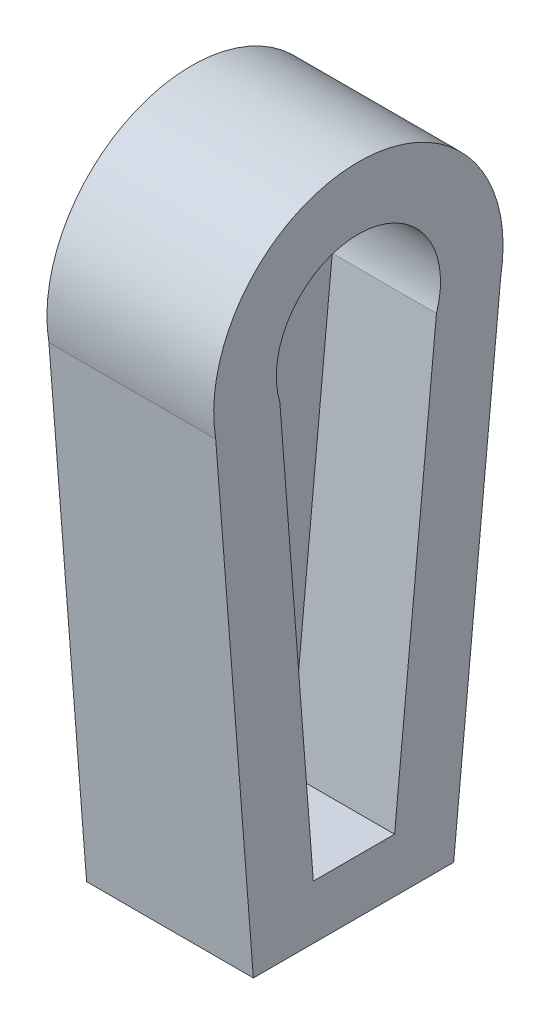
from build123d import *

# Parameters (mm, degrees)
BOSS_EXTRUDE1_DEPTH = 8
SKETCH1_3_R         = 2.375
BOSS_EXTRUDE2_DEPTH = 3


with BuildPart() as part:
    # Sketch1 → Boss-Extrude1 (new body)
    with BuildSketch(Plane(origin=(0, 0, 0), x_dir=(0, 0, -1), z_dir=(1, 0, 0))):
        with BuildLine():
            ThreePointArc((6.831434318, -1.221589567), (0.037477219, 6.939695337), (-6.84422965, -1.147735338))
            Line((-6.84422965, -1.147735338), (-5.036656509, -24.443075278))
            Line((-5.036656509, -24.443075278), (4.569647847, -24.443075278))
            Line((4.569647847, -24.443075278), (6.831434318, -1.221589567))
        make_face()
        with BuildLine():
            Line((-2.162031314, -21.856629017), (-3.768912351, -1.147735338))
            ThreePointArc((-3.768912351, -1.147735338), (0.038719155, 3.939606268), (3.745626202, -1.221589567))
            Line((3.745626202, -1.221589567), (1.73576113, -21.856629017))
            Line((1.73576113, -21.856629017), (-2.162031314, -21.856629017))
        make_face(mode=Mode.SUBTRACT)
    extrude(amount=BOSS_EXTRUDE1_DEPTH)

    # Sketch1<3> → Boss-Extrude2 (add)
    with BuildSketch(Plane(origin=(0, 0, 0), x_dir=(0, 0, -1), z_dir=(1, 0, 0))):
        with BuildLine():
            ThreePointArc((3.745626202, -1.221589567), (0.038719155, 3.939606268), (-3.768912351, -1.147735338))
            Line((-3.768912351, -1.147735338), (-2.162031314, -21.856629017))
            Line((-2.162031314, -21.856629017), (1.73576113, -21.856629017))
            Line((1.73576113, -21.856629017), (3.745626202, -1.221589567))
        make_face()
        Circle(SKETCH1_3_R, mode=Mode.SUBTRACT)
    extrude(amount=BOSS_EXTRUDE2_DEPTH)


solid = part.part
